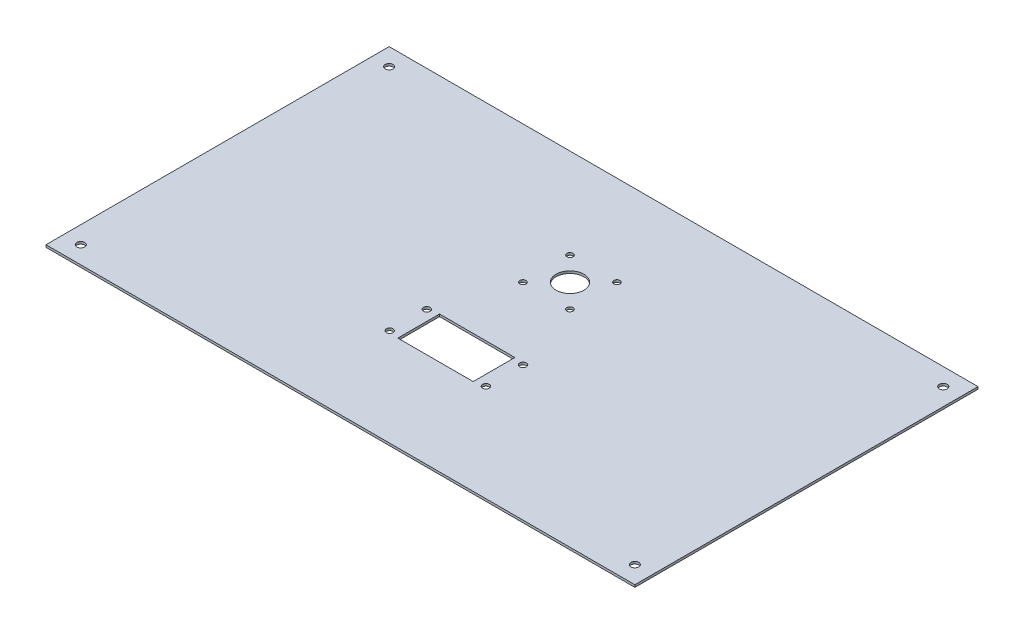
from build123d import *

# Parameters (mm, degrees)
SKETCH1_W           = 508
SKETCH1_H           = 296
BOSS_EXTRUDE1_DEPTH = 2
SKETCH2_R           = 12
SKETCH2_R_2         = 2.65
SKETCH2_R_3         = 2.9
SKETCH2_W           = 65
SKETCH2_H           = 36
CUT_EXTRUDE1_DEPTH  = 10
SKETCH4_R           = 3.4
CUT_EXTRUDE2_DEPTH  = 10


with BuildPart() as part:
    # Sketch1 → Boss-Extrude1 (new body)
    with BuildSketch(Plane(origin=(0, 0, 0), x_dir=(1, 0, 0), z_dir=(0, 1, 0))):
        Rectangle(SKETCH1_W, SKETCH1_H)
    extrude(amount=BOSS_EXTRUDE1_DEPTH)

    # Sketch2 → Cut-Extrude1 (cut)
    with BuildSketch(Plane(origin=(0, 2, 0), x_dir=(1, 0, 0), z_dir=(0, 1, 0))):
        with Locations(Location((0, 50, 0), (0, 0, 270))):
            Circle(SKETCH2_R)
        with Locations(Location((-20.28, 70.28, 0), (0, 0, 270))):
            Circle(SKETCH2_R_2)
        with Locations(Location((-20.28, 29.72, 0), (0, 0, 90))):
            Circle(SKETCH2_R_2)
        with Locations(Location((20.28, 29.72, 0), (0, 0, 270))):
            Circle(SKETCH2_R_2)
        with Locations(Location((20.28, 70.28, 0), (0, 0, 90))):
            Circle(SKETCH2_R_2)
        with Locations(Location((41.5, -32, 0), (0, 0, 270))):
            Circle(SKETCH2_R_3)
        with Locations(Location((41.5, -64, 0), (0, 0, 270))):
            Circle(SKETCH2_R_3)
        with Locations(Location((-41.5, -64, 0), (0, 0, 270))):
            Circle(SKETCH2_R_3)
        with Locations(Location((-41.5, -32, 0), (0, 0, 270))):
            Circle(SKETCH2_R_3)
        with Locations((0, -48)):
            Rectangle(SKETCH2_W, SKETCH2_H)
    extrude(amount=-CUT_EXTRUDE1_DEPTH, mode=Mode.SUBTRACT)

    # Sketch4 → Cut-Extrude2 (cut)
    with BuildSketch(Plane.XZ):
        with Locations(Location((-239, 133, 0), (0, 0, 270))):
            Circle(SKETCH4_R)
        with Locations(Location((239, 133, 0), (0, 0, 270))):
            Circle(SKETCH4_R)
        with Locations(Location((-239, -133, 0), (0, 0, 270))):
            Circle(SKETCH4_R)
        with Locations(Location((239, -133, 0), (0, 0, 270))):
            Circle(SKETCH4_R)
    extrude(amount=-CUT_EXTRUDE2_DEPTH, mode=Mode.SUBTRACT)


solid = part.part
